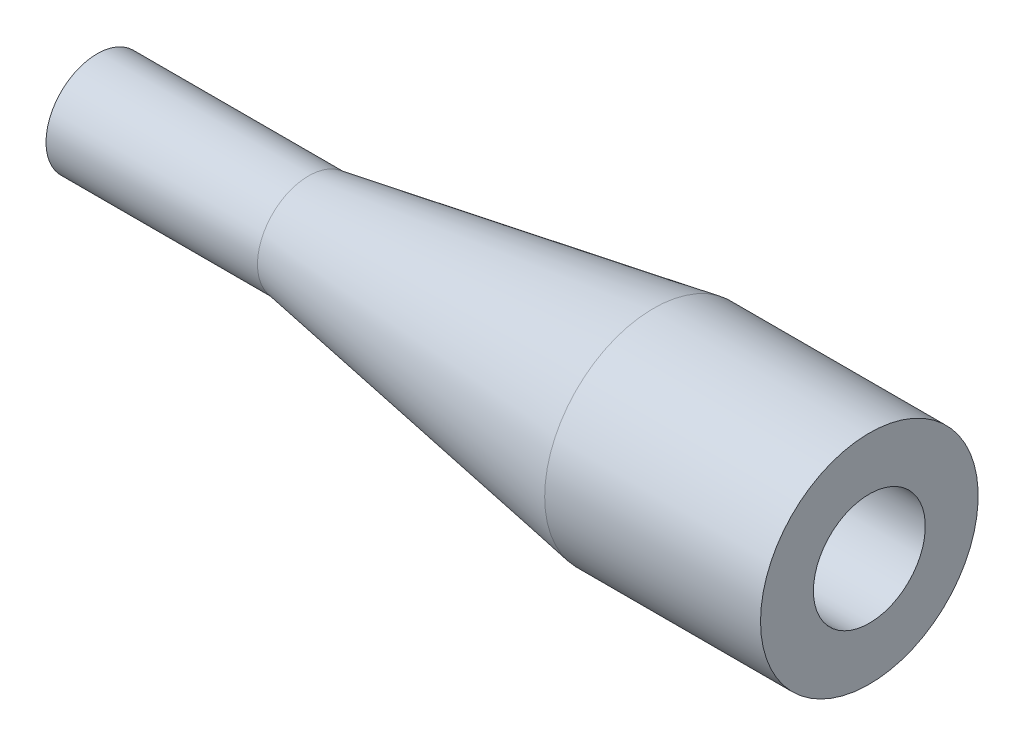
from build123d import *


with BuildPart() as part:
    # Sketch1 → Revolve1 (revolve)
    with BuildSketch(Plane(origin=(0, 0, 0), x_dir=(1, 0, 0), z_dir=(0, 1, 0)), mode=Mode.PRIVATE) as revolve1_sk:
        Polygon((0, 0.9), (12, 0.9), (31.820723432, 2.286), (31.820723432, 3.175), (43.820723432, 3.175), (43.820723432, 6.175), (31.571453015, 6.175), (12, 2.9), (0, 2.9), align=None)
    revolve(revolve1_sk.sketch.rotate(Axis((0, 0, 0), (1, 0, 0)), 180), axis=Axis((0, 0, 0), (1, 0, 0)))


solid = part.part
